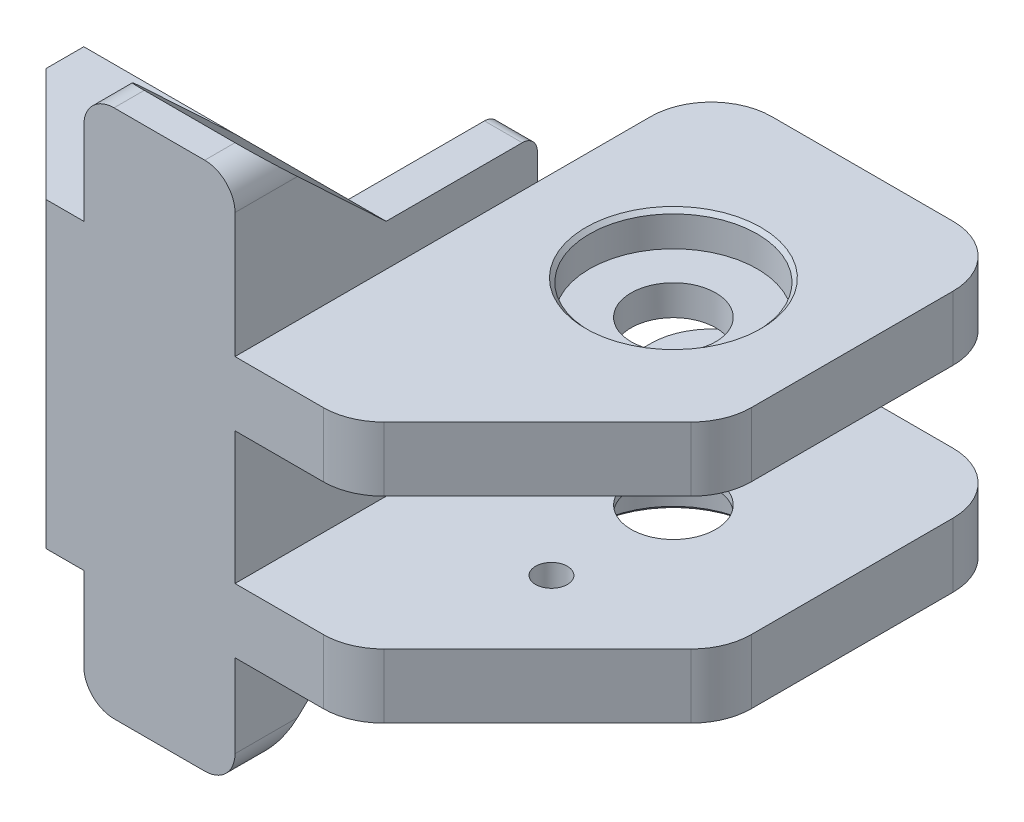
from build123d import *

# Parameters (mm, degrees)
SKETCH1_W                = 40
SKETCH1_H                = 40
BOSS_EXTRUDE1_DEPTH      = 40
SKETCH2_W                = 25
SKETCH2_H                = 20
CUT_EXTRUDE1_DEPTH       = 40
CHAMFER1_SIZE            = 15
CUT_EXTRUDE2_DEPTH       = 15
CHAMFER2_SIZE            = 4
SKETCH4_R                = 2.6
CUT_EXTRUDE3_DEPTH       = 17
BOSS_EXTRUDE2_DEPTH      = 8
BOSS_EXTRUDE2_DEPTH_BACK = 40
SKETCH5_W                = 40
SKETCH5_H                = 8.5
SKETCH10_W               = 14
SKETCH10_H               = 10
CUT_EXTRUDE5_DEPTH       = 26
SKETCH8_R                = 5.6
CUT_EXTRUDE4_DEPTH       = 34
BOSS_EXTRUDE3_DEPTH      = 20
FILLET3_R                = 4
FILLET4_R                = 2
CHAMFER7_SIZE            = 25
CHAMFER8_SIZE            = 2
CHAMFER8_SIZE2           = 10
FILLET7_R                = 2
SKETCH14_W               = 40
SKETCH14_H               = 8.5
BOSS_EXTRUDE4_DEPTH      = 15
SKETCH16_W               = 40
SKETCH16_H               = 8.5
BOSS_EXTRUDE5_DEPTH      = 15
SKETCH12_R               = 11.1
CUT_EXTRUDE6_DEPTH       = 4.5
CUT_EXTRUDE7_START       = -7.5
SKETCH13_R               = 11.1
CUT_EXTRUDE7_DEPTH       = 7.5
SKETCH15_R               = 2.1
CUT_EXTRUDE8_DEPTH       = 10
CHAMFER10_SIZE           = 0.5
FILLET8_R                = 8
CUT_EXTRUDE9_DEPTH       = 10


with BuildPart() as part:
    # Sketch1 → Boss-Extrude1 (new body)
    with BuildSketch(Plane(origin=(0, 0, 0), x_dir=(1, 0, 0), z_dir=(0, 1, 0))):
        with Locations((20, 20)):
            Rectangle(SKETCH1_W, SKETCH1_H)
    extrude(amount=BOSS_EXTRUDE1_DEPTH)

    # Sketch2 → Cut-Extrude1 (cut)
    with BuildSketch(Plane(origin=(0, 40, 0), x_dir=(1, 0, 0), z_dir=(0, 1, 0))):
        with Locations((12.5, 30)):
            Rectangle(SKETCH2_W, SKETCH2_H)
    extrude(amount=-CUT_EXTRUDE1_DEPTH, mode=Mode.SUBTRACT)

    # Chamfer1
    chamfer1_edges = [part.edges().sort_by_distance(p)[0] for p in [
        (0, 20, 0),
    ]]
    chamfer(chamfer1_edges, length=CHAMFER1_SIZE)

    # Sketch3 → Cut-Extrude2 (cut)
    with BuildSketch(Plane.XY):
        Polygon((0, 10), (0, 15), (15, 15), (15, 5), (0, 5), align=None)
        Polygon((0, 30), (0, 25), (15, 25), (15, 35), (0, 35), align=None)
    extrude(amount=-CUT_EXTRUDE2_DEPTH, mode=Mode.SUBTRACT)

    # Chamfer2
    chamfer2_edges = [part.edges().sort_by_distance(p)[0] for p in [
        (15, 35, -7.5),
        (15, 25, -7.5),
        (15, 15, -7.5),
        (15, 5, -7.5),
    ]]
    chamfer(chamfer2_edges, length=CHAMFER2_SIZE)

    # Sketch4 → Cut-Extrude3 (cut)
    with BuildSketch(Plane.XY.offset(-15)):
        with Locations((8, 30)):
            Circle(SKETCH4_R)
        with Locations((8, 10)):
            Circle(SKETCH4_R)
    extrude(amount=-CUT_EXTRUDE3_DEPTH, mode=Mode.SUBTRACT)

    # Sketch5 → Boss-Extrude2 (add, two sides: drawn at the far end of the back side and taken through both)
    with BuildSketch(Plane(origin=(0, 0, -40), x_dir=(-1, 0, 0), z_dir=(0, 0, -1)).offset(-BOSS_EXTRUDE2_DEPTH_BACK)):
        with Locations((-60, 4.25)):
            Rectangle(SKETCH5_W, SKETCH5_H)
        with Locations((-60, 30.25)):
            Rectangle(SKETCH5_W, SKETCH5_H)
    extrude(amount=BOSS_EXTRUDE2_DEPTH + BOSS_EXTRUDE2_DEPTH_BACK)

    # Sketch10 → Cut-Extrude5 (cut)
    with BuildSketch(Plane(origin=(40, 0, 0), x_dir=(0, 0, -1), z_dir=(1, 0, 0))):
        with Locations((29, 20)):
            Rectangle(SKETCH10_W, SKETCH10_H)
    extrude(amount=-CUT_EXTRUDE5_DEPTH, mode=Mode.SUBTRACT)

    # Sketch8 → Cut-Extrude4 (cut)
    with BuildSketch(Plane(origin=(0, 32, 0), x_dir=(1, 0, 0), z_dir=(0, 1, 0))):
        with Locations(Location((60, 38, 0), (0, 0, 270))):
            Circle(SKETCH8_R)
    extrude(amount=-CUT_EXTRUDE4_DEPTH, mode=Mode.SUBTRACT)

    # Sketch9 → Boss-Extrude3 (add)
    with BuildSketch(Plane(origin=(40, 0, 0), x_dir=(0, 0, -1), z_dir=(1, 0, 0))):
        Polygon((0, 40), (0, 55), (4, 55), (20, 40), align=None)
        Polygon((0, 0), (0, -15), (4, -15), (20, 0), align=None)
    extrude(amount=-BOSS_EXTRUDE3_DEPTH)

    # Fillet3
    fillet3_edges = [part.edges().sort_by_distance(p)[0] for p in [
        (20, 55, -2),
        (40, 55, -2),
        (20, -15, -2),
        (40, -15, -2),
    ]]
    fillet(fillet3_edges, radius=FILLET3_R)

    # Fillet4
    fillet4_edges = [part.edges().sort_by_distance(p)[0] for p in [
        (32.5, 40, -40),
        (32.5, 0, -40),
    ]]
    fillet(fillet4_edges, radius=FILLET4_R)

    # Chamfer7
    chamfer7_edges = [part.edges().sort_by_distance(p)[0] for p in [
        (80, 4.25, 0),
        (80, 30.25, 0),
    ]]
    chamfer(chamfer7_edges, length=CHAMFER7_SIZE)

    # Chamfer8
    chamfer8_edges = [part.edges().sort_by_distance(p)[0] for p in [
        (40, 20, -36),
    ]]
    chamfer8_side = [part.faces().sort_by_distance(p)[0] for p in [
        (40, 16.5625, -17.75),
    ]]
    chamfer(chamfer8_edges, length=CHAMFER8_SIZE, length2=CHAMFER8_SIZE2, reference=chamfer8_side[0])

    # Fillet7
    fillet7_edges = [part.edges().sort_by_distance(p)[0] for p in [
        (27.5, 15, -36),
        (32.5, 15, -22),
        (32.5, 25, -22),
        (27.5, 25, -36),
        (35, 25, -37),
        (35, 15, -37),
    ]]
    fillet(fillet7_edges, radius=FILLET7_R)

    # Sketch14 → Boss-Extrude4 (add)
    with BuildSketch(Plane(origin=(0, 0, -48), x_dir=(-1, 0, 0), z_dir=(0, 0, -1))):
        with Locations((-60, 4.25)):
            Rectangle(SKETCH14_W, SKETCH14_H)
    extrude(amount=BOSS_EXTRUDE4_DEPTH)

    # Sketch16 → Boss-Extrude5 (add)
    with BuildSketch(Plane(origin=(0, 0, -48), x_dir=(-1, 0, 0), z_dir=(0, 0, -1))):
        with Locations((-60, 30.25)):
            Rectangle(SKETCH16_W, SKETCH16_H)
    extrude(amount=BOSS_EXTRUDE5_DEPTH)

    # Sketch12 → Cut-Extrude6 (cut)
    with BuildSketch(Plane(origin=(0, 34.5, 0), x_dir=(1, 0, 0), z_dir=(0, 1, 0))):
        with Locations(Location((60, 38, 0), (0, 0, 180))):
            Circle(SKETCH12_R)
    extrude(amount=-CUT_EXTRUDE6_DEPTH, mode=Mode.SUBTRACT)

    # Sketch13 → Cut-Extrude7 (cut)
    with BuildSketch(Plane.XZ.offset(CUT_EXTRUDE7_START)):
        with Locations(Location((60, -38, 0), (0, 0, 180))):
            Circle(SKETCH13_R)
    extrude(amount=CUT_EXTRUDE7_DEPTH, mode=Mode.SUBTRACT)

    # Sketch15 → Cut-Extrude8 (cut)
    with BuildSketch(Plane.XZ):
        with Locations(Location((60, -54.130501699, 0), (0, 0, 270))):
            Circle(SKETCH15_R)
        with Locations(Location((60, -21.869498301, 0), (0, 0, 270))):
            Circle(SKETCH15_R)
    extrude(amount=-CUT_EXTRUDE8_DEPTH, mode=Mode.SUBTRACT)

    # Chamfer10
    chamfer10_edges = [part.edges().sort_by_distance(p)[0] for p in [
        (71.1, 34.5, -38),
        (71.1, 0, -38),
    ]]
    chamfer(chamfer10_edges, length=CHAMFER10_SIZE)

    # Fillet8
    fillet8_edges = [part.edges().sort_by_distance(p)[0] for p in [
        (55, 30.25, 0),
        (55, 4.25, 0),
        (80, 4.25, -25),
        (80, 30.25, -25),
        (80, 4.25, -63),
        (40, 4.25, -63),
        (80, 30.25, -63),
        (40, 30.25, -63),
    ]]
    fillet(fillet8_edges, radius=FILLET8_R)

    # Sketch17 → Cut-Extrude9 (cut)
    with BuildSketch(Plane.ZY.offset(-25)):
        Polygon((-20, 0), (-20, 68.838193982), (-62.566783677, 68.838193982), (-62.566783677, -51.070720767), align=None)
    extrude(amount=-CUT_EXTRUDE9_DEPTH, mode=Mode.SUBTRACT)


solid = part.part
